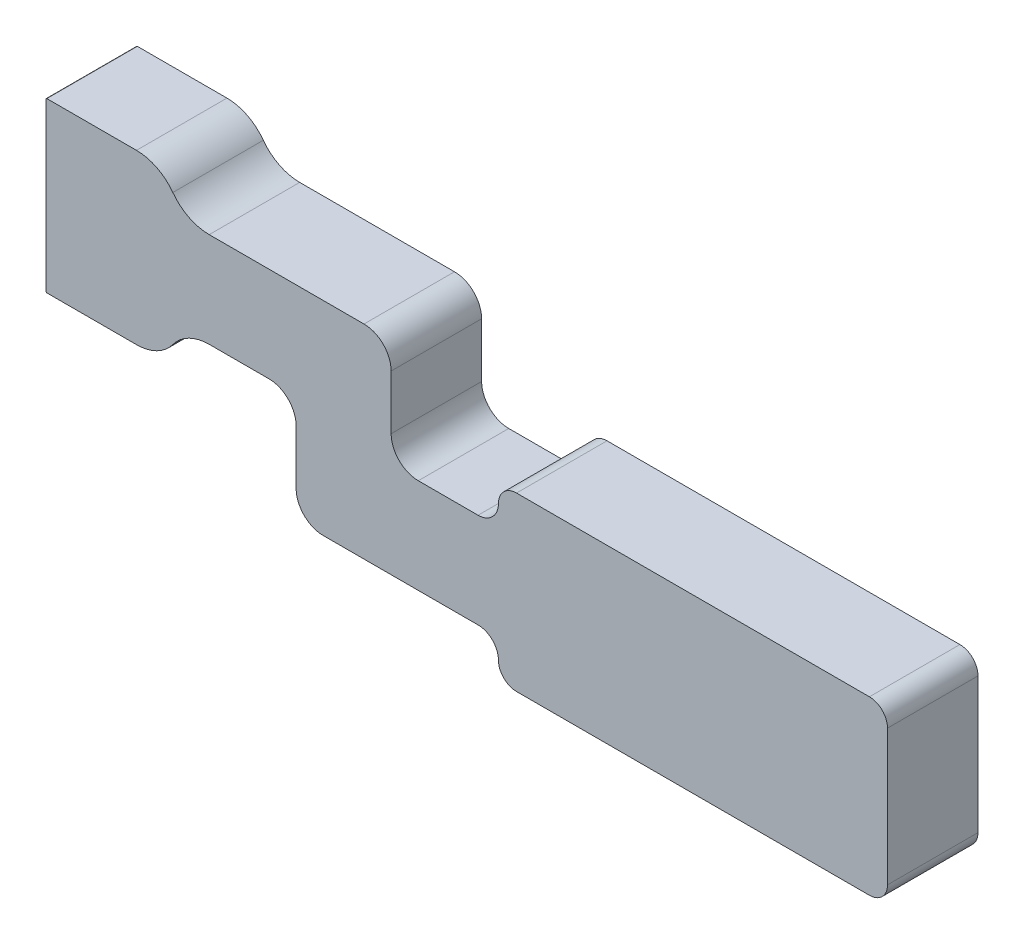
from build123d import *

# Parameters (mm, degrees)
BOSS_EXTRUDE2_DEPTH = 10


with BuildPart() as part:
    # Sketch1 → Boss-Extrude2 (new body)
    with BuildSketch(Plane(origin=(0, 0, 0), x_dir=(0, 1, 0), z_dir=(0, 0, 1))):
        with BuildLine():
            Line((21.3, 83), (21.3, 92.9))
            ThreePointArc((21.3, 92.9), (21.270710678, 92.970710678), (21.2, 93))
            Line((21.2, 93), (2.8, 93))
            ThreePointArc((2.8, 93), (2.729289322, 92.970710678), (2.7, 92.9))
            Line((2.7, 92.9), (2.7, 83))
            ThreePointArc((2.7, 83), (3.234857225, 80.75), (4.725, 78.981371503))
            ThreePointArc((4.725, 78.981371503), (6.215142775, 77.212743005), (6.75, 74.962743005))
            Line((6.75, 74.962743005), (6.75, 68.356371503))
            ThreePointArc((6.75, 68.356371503), (5.871320344, 66.235051159), (3.75, 65.356371503))
            Line((3.75, 65.356371503), (-2.25, 65.356371503))
            ThreePointArc((-2.25, 65.356371503), (-4.371320344, 64.477691846), (-5.25, 62.356371503))
            Line((-5.25, 62.356371503), (-5.25, 45.25))
            ThreePointArc((-5.25, 45.25), (-5.909009742, 43.659009742), (-7.5, 43))
            ThreePointArc((-7.5, 43), (-8.914213562, 42.414213562), (-9.5, 41))
            Line((-9.5, 41), (-9.5, 2))
            ThreePointArc((-9.5, 2), (-8.914213562, 0.585786438), (-7.5, 0))
            Line((-7.5, 0), (7.5, 0))
            ThreePointArc((7.5, 0), (8.914213562, 0.585786438), (9.5, 2))
            Line((9.5, 2), (9.5, 41))
            ThreePointArc((9.5, 41), (8.914213562, 42.414213562), (7.5, 43))
            ThreePointArc((7.5, 43), (5.909009742, 43.659009742), (5.25, 45.25))
            Line((5.25, 45.25), (5.25, 51.856371503))
            ThreePointArc((5.25, 51.856371503), (6.128679656, 53.977691846), (8.25, 54.856371503))
            Line((8.25, 54.856371503), (14.25, 54.856371503))
            ThreePointArc((14.25, 54.856371503), (16.371320344, 55.735051159), (17.25, 57.856371503))
            Line((17.25, 57.856371503), (17.25, 74.962743005))
            ThreePointArc((17.25, 74.962743005), (17.784857225, 77.212743005), (19.275, 78.981371503))
            ThreePointArc((19.275, 78.981371503), (20.765142775, 80.75), (21.3, 83))
        make_face()
    extrude(amount=BOSS_EXTRUDE2_DEPTH)


solid = part.part
